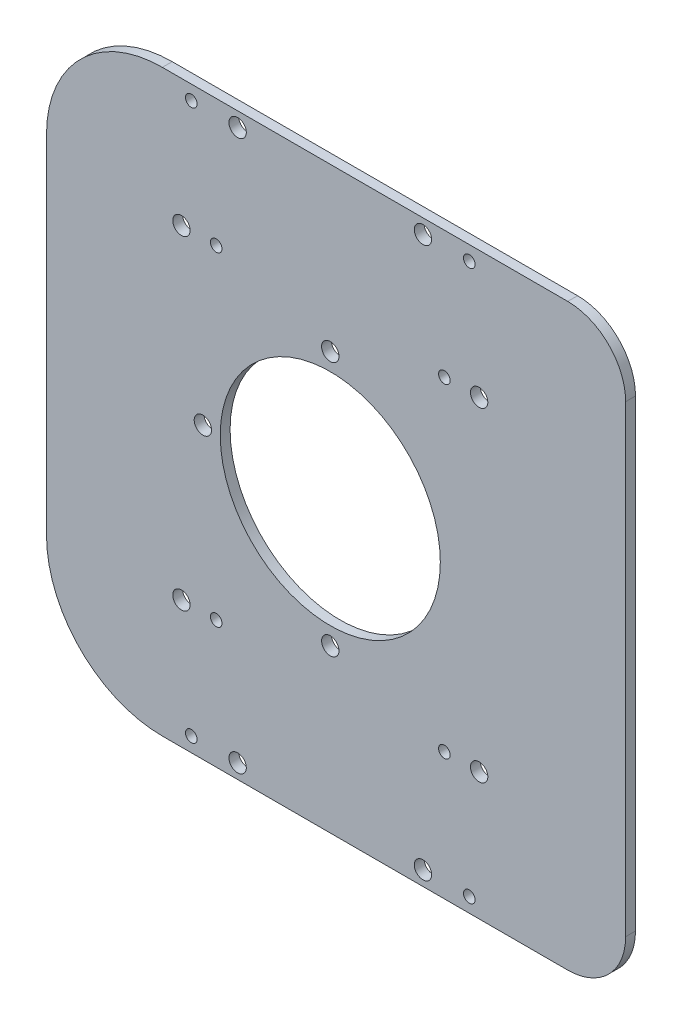
from build123d import *

# Parameters (mm, degrees)
SKETCH_1_W          = 58
SKETCH_1_H          = 100
SKETCH_1_R          = 1
SKETCH_1_R_2        = 1.5
EXTRUDE_1_DEPTH     = 3
SKETCH_2_R          = 19
SKETCH_2_R_2        = 1.5
CUT_EXTRUDE_1_DEPTH = 10
SKETCH_2_3_W        = 20
SKETCH_2_3_H        = 100
SKETCH_2_3_W_2      = 22
EXTRUDE_2_DEPTH     = 3
FILLET_1_R          = 20
FILLET_2_R          = 10
CUT_EXTRUDE_2_DEPTH = 1.3


with BuildPart() as part:
    # 草图1 → 凸台-拉伸1 (new body)
    with BuildSketch(Plane.XY):
        Rectangle(SKETCH_1_W, SKETCH_1_H)
        with Locations((-24, 47.5)):
            Circle(SKETCH_1_R, mode=Mode.SUBTRACT)
        with Locations((-16, 47.5)):
            Circle(SKETCH_1_R_2, mode=Mode.SUBTRACT)
        with Locations((16, 47.5)):
            Circle(SKETCH_1_R_2, mode=Mode.SUBTRACT)
        with Locations((24, 47.5)):
            Circle(SKETCH_1_R, mode=Mode.SUBTRACT)
        with Locations((-19.7, 28)):
            Circle(SKETCH_1_R, mode=Mode.SUBTRACT)
        with Locations((-25.7, 28)):
            Circle(SKETCH_1_R_2, mode=Mode.SUBTRACT)
        with Locations((19.7, 28)):
            Circle(SKETCH_1_R, mode=Mode.SUBTRACT)
        with Locations((25.7, 28)):
            Circle(SKETCH_1_R_2, mode=Mode.SUBTRACT)
        with Locations((25.7, -28)):
            Circle(SKETCH_1_R_2, mode=Mode.SUBTRACT)
        with Locations((24, -47.5)):
            Circle(SKETCH_1_R, mode=Mode.SUBTRACT)
        with Locations((16, -47.5)):
            Circle(SKETCH_1_R_2, mode=Mode.SUBTRACT)
        with Locations((19.7, -28)):
            Circle(SKETCH_1_R, mode=Mode.SUBTRACT)
        with Locations((-19.7, -28)):
            Circle(SKETCH_1_R, mode=Mode.SUBTRACT)
        with Locations((-25.7, -28)):
            Circle(SKETCH_1_R_2, mode=Mode.SUBTRACT)
        with Locations((-24, -47.5)):
            Circle(SKETCH_1_R, mode=Mode.SUBTRACT)
        with Locations((-16, -47.5)):
            Circle(SKETCH_1_R_2, mode=Mode.SUBTRACT)
    extrude(amount=EXTRUDE_1_DEPTH)

    # 草图2 → 切除-拉伸1 (cut)
    with BuildSketch(Plane.XY.offset(3)):
        Circle(SKETCH_2_R)
        with Locations((0, 22)):
            Circle(SKETCH_2_R_2)
        with Locations((-22, 0)):
            Circle(SKETCH_2_R_2)
        with Locations((0, -22)):
            Circle(SKETCH_2_R_2)
    extrude(amount=-CUT_EXTRUDE_1_DEPTH, mode=Mode.SUBTRACT)

    # 草图2<3> → 凸台-拉伸2 (add)
    with BuildSketch(Plane.XY.offset(3)):
        with Locations((-39, 0)):
            Rectangle(SKETCH_2_3_W, SKETCH_2_3_H)
        with Locations((40, 0)):
            Rectangle(SKETCH_2_3_W_2, SKETCH_2_3_H)
    extrude(amount=-EXTRUDE_2_DEPTH)

    # 圆角1
    fillet_1_edges = [part.edges().sort_by_distance(p)[0] for p in [
        (-49, 50, 1.5),
        (-49, -50, 1.5),
    ]]
    fillet(fillet_1_edges, radius=FILLET_1_R)

    # 圆角2
    fillet_2_edges = [part.edges().sort_by_distance(p)[0] for p in [
        (51, 50, 1.5),
        (51, -50, 1.5),
    ]]
    fillet(fillet_2_edges, radius=FILLET_2_R)

    # 草图3 → 切除-拉伸2 (cut)
    with BuildSketch(Plane(origin=(0, 0, 0), x_dir=(-1, 0, 0), z_dir=(0, 0, -1))):
        with BuildLine():
            Line((29, 50), (-41, 50))
            ThreePointArc((-41, 50), (-48.071067812, 47.071067812), (-51, 40))
            Line((-51, 40), (-51, -40))
            ThreePointArc((-51, -40), (-48.071067812, -47.071067812), (-41, -50))
            Line((-41, -50), (29, -50))
            ThreePointArc((29, -50), (43.142135624, -44.142135624), (49, -30))
            Line((49, -30), (49, 30))
            ThreePointArc((49, 30), (43.142135624, 44.142135624), (29, 50))
        make_face()
    extrude(amount=-CUT_EXTRUDE_2_DEPTH, mode=Mode.SUBTRACT)


solid = part.part
